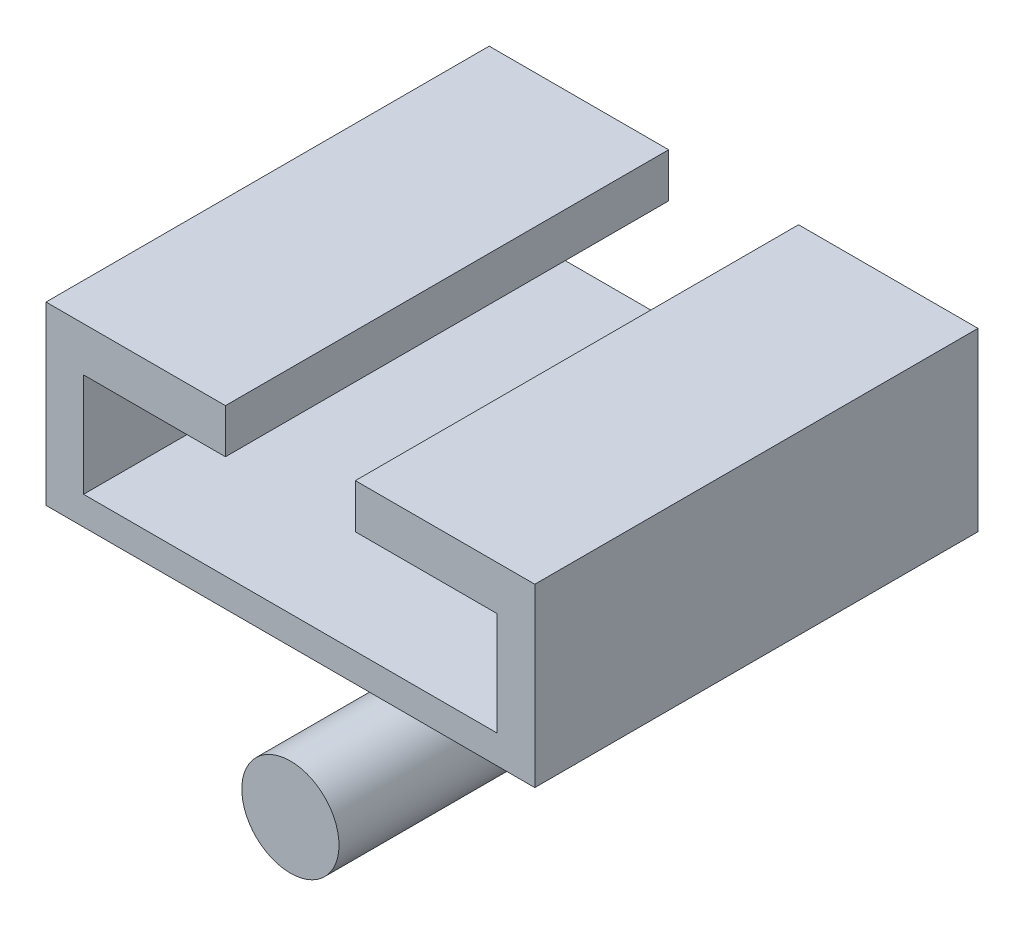
from build123d import *

# Parameters (mm, degrees)
SKETCH1_W           = 84.040425815
SKETCH1_H           = 30.284008864
BOSS_EXTRUDE1_DEPTH = 76.2
CUT_EXTRUDE1_DEPTH  = 118.415307197
SKETCH3_W           = 16.716926531
SKETCH3_H           = 25.4
BOSS_EXTRUDE2_DEPTH = 6.35
SKETCH4_R           = 8.358463265
BOSS_EXTRUDE3_DEPTH = 76.2


with BuildPart() as part:
    # Sketch1 → Boss-Extrude1 (new body)
    with BuildSketch(Plane.XY):
        with Locations((42.020212908, 15.142004432)):
            Rectangle(SKETCH1_W, SKETCH1_H)
    extrude(amount=-BOSS_EXTRUDE1_DEPTH)

    # Sketch2 → Cut-Extrude1 (cut, through all)
    with BuildSketch(Plane.XY):
        Polygon((30.853035266, 30.284008864), (53.187390549, 30.284008864), (53.187390549, 22.664008864), (77.580212908, 22.664008864), (77.580212908, 4.884008864), (6.460212908, 4.884008864), (6.460212908, 22.664008864), (30.853035266, 22.664008864), align=None)
    extrude(amount=-CUT_EXTRUDE1_DEPTH, mode=Mode.SUBTRACT)

    # Sketch3 → Boss-Extrude2 (add)
    with BuildSketch(Plane.XY.offset(-76.2)):
        with Locations((42.020212908, -12.7)):
            Rectangle(SKETCH3_W, SKETCH3_H)
    extrude(amount=BOSS_EXTRUDE2_DEPTH)

    # Sketch4 → Boss-Extrude3 (add)
    with BuildSketch(Plane.XY.offset(-76.2)):
        with Locations((42.020212908, -25.4)):
            Circle(SKETCH4_R)
    extrude(amount=BOSS_EXTRUDE3_DEPTH)


solid = part.part
